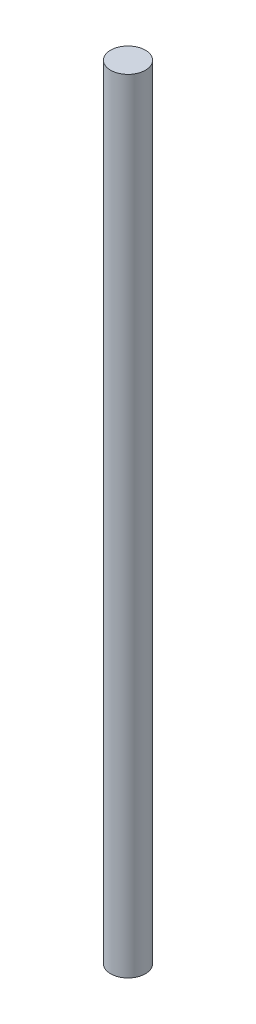
from build123d import *

# Parameters (mm, degrees)
SKETCH1_R           = 2
BOSS_EXTRUDE1_DEPTH = 90


with BuildPart() as part:
    # Sketch1 → Boss-Extrude1 (new body)
    with BuildSketch(Plane(origin=(0, 0, 0), x_dir=(1, 0, 0), z_dir=(0, 1, 0))):
        with Locations(Location((-10.14119498, 2.035641328, 0), (0, 0, 90))):
            Circle(SKETCH1_R)
    extrude(amount=BOSS_EXTRUDE1_DEPTH)


solid = part.part
